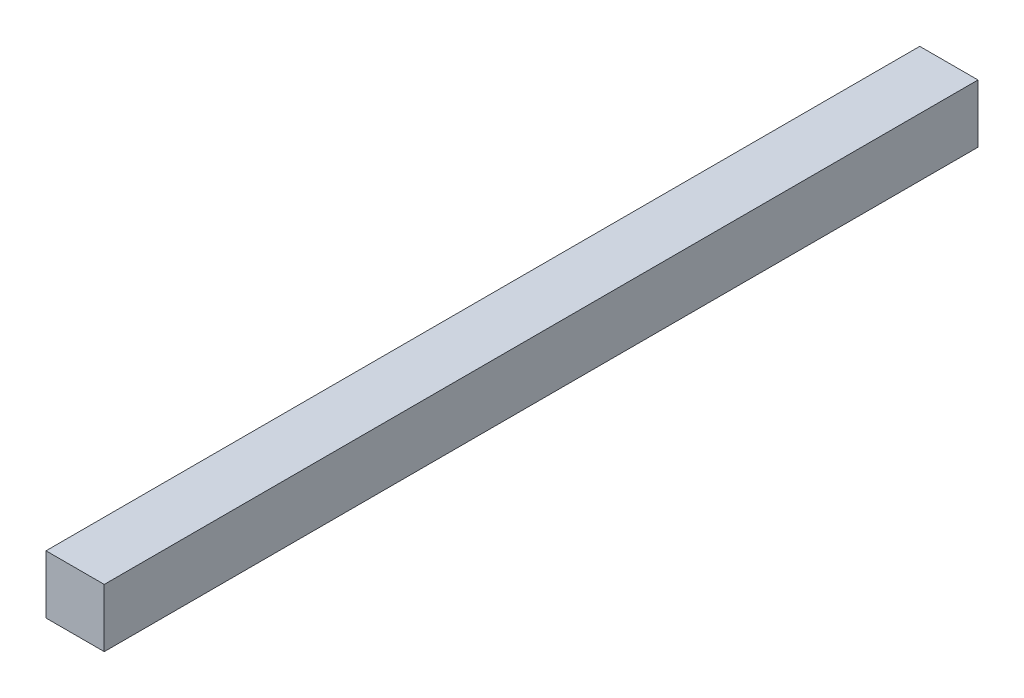
from build123d import *

# Parameters (mm, degrees)
SKETCH1_W           = 10
SKETCH1_H           = 10
BOSS_EXTRUDE1_DEPTH = 150


with BuildPart() as part:
    # Sketch1 → Boss-Extrude1 (new body)
    with BuildSketch(Plane.XY):
        with Locations((5, 5)):
            Rectangle(SKETCH1_W, SKETCH1_H)
    extrude(amount=BOSS_EXTRUDE1_DEPTH)


solid = part.part
